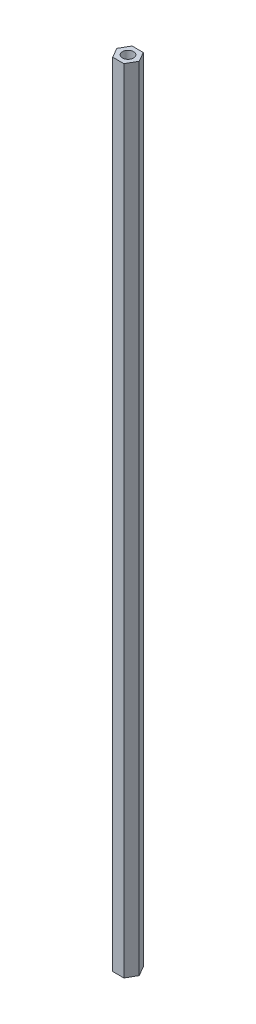
from build123d import *

# Parameters (mm, degrees)
SKETCH1_R           = 2
BOSS_EXTRUDE1_DEPTH = 286


with BuildPart() as part:
    # Sketch1 → Boss-Extrude1 (new body)
    with BuildSketch(Plane(origin=(0, 0, 0), x_dir=(1, 0, 0), z_dir=(0, 1, 0))):
        Polygon((2.020725942, 3.5), (-2.020725942, 3.5), (-4.041451884, 0), (-2.020725942, -3.5), (2.020725942, -3.5), (4.041451884, 0), align=None)
        with Locations(Location((0, 0, 0), (0, 0, 270))):
            Circle(SKETCH1_R, mode=Mode.SUBTRACT)
    extrude(amount=BOSS_EXTRUDE1_DEPTH)


solid = part.part
